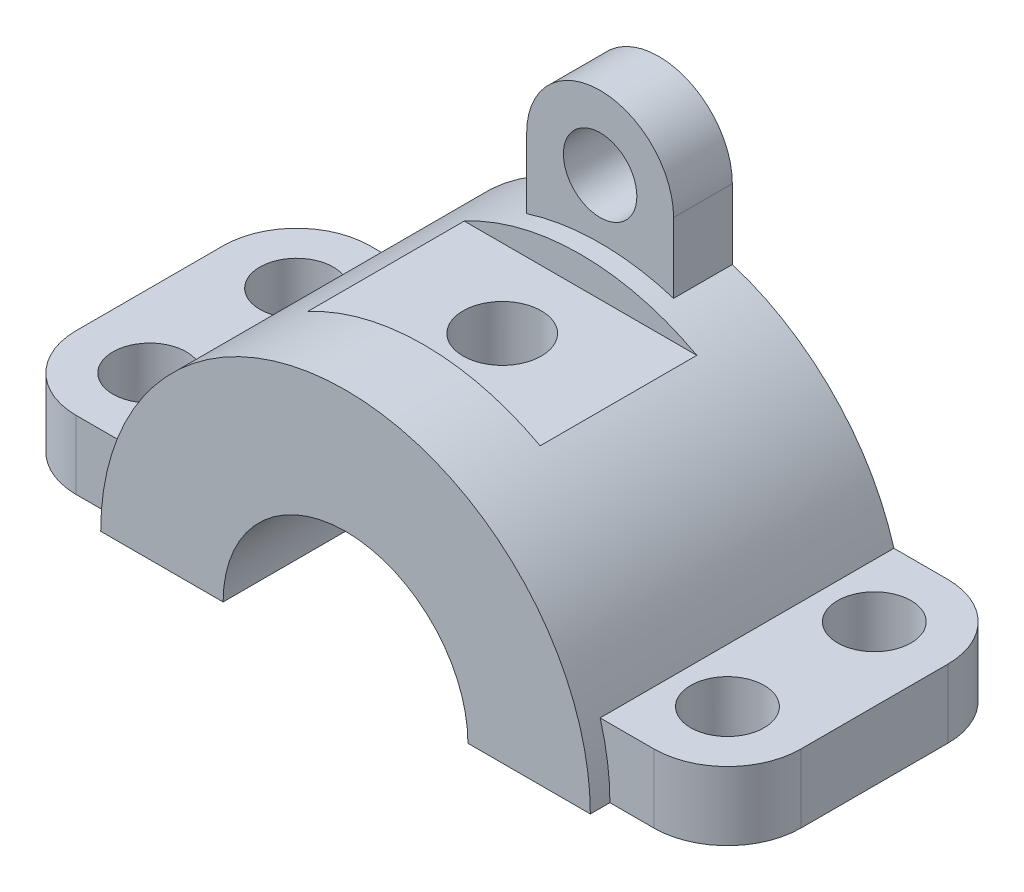
from build123d import *

# Parameters (mm, degrees)
EXTRUDE_1_DEPTH          = 64
EXTRUDE_2_DEPTH          = 60
SKETCH_1_4_R             = 7.5
EXTRUDE_3_DEPTH          = 12
FILLET_1_R               = 15
CUT_EXTRUDE_1_DEPTH      = 117.365802537
CUT_EXTRUDE_1_DEPTH_BACK = 117.365802537
SKETCH_3_R               = 7.5
CUT_EXTRUDE_START        = -48
CUT_EXTRUDE_2_DEPTH      = 32
SKETCH_5_R               = 8
CUT_EXTRUDE_3_DEPTH      = 108.275346655


with BuildPart() as part:
    # 草图1 → 凸台-拉伸1 (new body)
    with BuildSketch(Plane.XY):
        with BuildLine():
            ThreePointArc((-48, 14), (-49.497474683, 7.071067812), (-50, 0))
            Line((-50, 0), (-25, 0))
            ThreePointArc((-25, 0), (0, 25), (25, 0))
            Line((25, 0), (50, 0))
            ThreePointArc((50, 0), (49.497474683, 7.071067812), (48, 14))
            ThreePointArc((48, 14), (35.722839746, 34.983978054), (15, 47.696960071))
            ThreePointArc((15, 47.696960071), (0, 50), (-15, 47.696960071))
            ThreePointArc((-15, 47.696960071), (-35.722839746, 34.983978054), (-48, 14))
        make_face()
    extrude(amount=EXTRUDE_1_DEPTH)

    # 草图1<3> → 凸台-拉伸2 (add)
    with BuildSketch(Plane.XY):
        with BuildLine():
            Line((-74, 14), (-74, 0))
            Line((-74, 0), (-50, 0))
            ThreePointArc((-50, 0), (-49.497474683, 7.071067812), (-48, 14))
            Line((-48, 14), (-74, 14))
        make_face()
        with BuildLine():
            ThreePointArc((48, 14), (49.497474683, 7.071067812), (50, 0))
            Line((50, 0), (74, 0))
            Line((74, 0), (74, 14))
            Line((74, 14), (48, 14))
        make_face()
    extrude(amount=EXTRUDE_2_DEPTH)

    # 草图1<4> → 凸台-拉伸3 (add)
    with BuildSketch(Plane.XY):
        with BuildLine():
            Line((-15, 62), (-15, 47.696960071))
            ThreePointArc((-15, 47.696960071), (0, 50), (15, 47.696960071))
            Line((15, 47.696960071), (15, 62))
            ThreePointArc((15, 62), (0, 77), (-15, 62))
        make_face()
        with Locations((0, 62)):
            Circle(SKETCH_1_4_R, mode=Mode.SUBTRACT)
    extrude(amount=EXTRUDE_3_DEPTH)

    # 圆角1
    fillet_1_edges = [part.edges().sort_by_distance(p)[0] for p in [
        (74, 7, 0),
        (74, 7, 60),
        (-74, 7, 60),
        (-74, 7, 0),
    ]]
    fillet(fillet_1_edges, radius=FILLET_1_R)

    # 草图3 → 切除-拉伸1 (cut, two sides: drawn at the far end of the back side and taken through both)
    with BuildSketch(Plane(origin=(0, 14, 0), x_dir=(1, 0, 0), z_dir=(0, 1, 0)).offset(-CUT_EXTRUDE_1_DEPTH_BACK)):
        with Locations((-59, -15)):
            Circle(SKETCH_3_R)
        with Locations((-59, -45)):
            Circle(SKETCH_3_R)
        with Locations((59, -15)):
            Circle(SKETCH_3_R)
        with Locations((59, -45)):
            Circle(SKETCH_3_R)
    extrude(amount=CUT_EXTRUDE_1_DEPTH + CUT_EXTRUDE_1_DEPTH_BACK, mode=Mode.SUBTRACT)

    # 草图4 → 切除-拉伸2 (cut)
    with BuildSketch(Plane.XY.offset(64).offset(CUT_EXTRUDE_START)):
        with BuildLine():
            Line((-23.748684174, 44), (23.748684174, 44))
            ThreePointArc((23.748684174, 44), (0, 50), (-23.748684174, 44))
        make_face()
    extrude(amount=CUT_EXTRUDE_2_DEPTH, mode=Mode.SUBTRACT)

    # 草图5 → 切除-拉伸3 (cut, through all)
    with BuildSketch(Plane(origin=(0, 44, 0), x_dir=(1, 0, 0), z_dir=(0, 1, 0))):
        with Locations((0, -32)):
            Circle(SKETCH_5_R)
    extrude(amount=-CUT_EXTRUDE_3_DEPTH, mode=Mode.SUBTRACT)


solid = part.part
